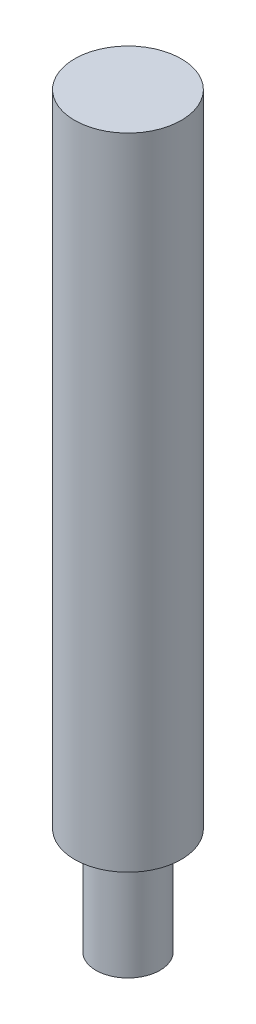
from build123d import *

# Parameters (mm, degrees)
SKETCH1_R           = 2.5
BOSS_EXTRUDE1_DEPTH = 30
SKETCH2_R           = 1.5
BOSS_EXTRUDE2_DEPTH = 5


with BuildPart() as part:
    # Sketch1 → Boss-Extrude1 (new body)
    with BuildSketch(Plane(origin=(0, 0, 0), x_dir=(1, 0, 0), z_dir=(0, 1, 0))):
        with Locations(Location((0, 0, 0), (0, 0, 270))):
            Circle(SKETCH1_R)
    extrude(amount=BOSS_EXTRUDE1_DEPTH)

    # Sketch2 → Boss-Extrude2 (add)
    with BuildSketch(Plane(origin=(0, 0, 0), x_dir=(-1, 0, 0), z_dir=(0, -1, 0))):
        with Locations(Location((0, 0, 0), (0, 0, 270))):
            Circle(SKETCH2_R)
    extrude(amount=BOSS_EXTRUDE2_DEPTH)


solid = part.part
